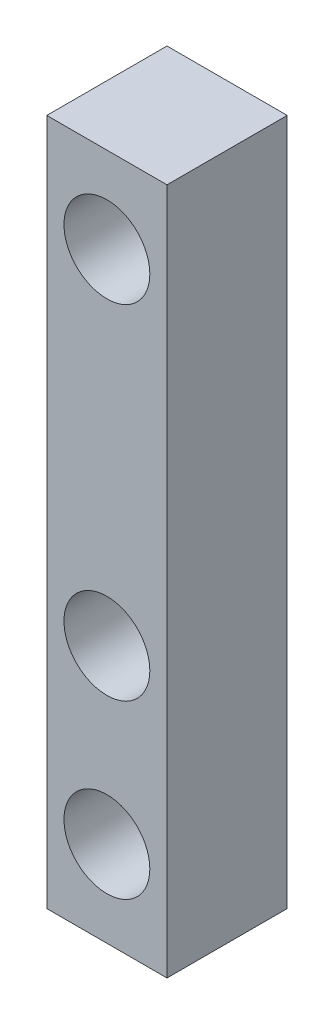
from build123d import *

# Parameters (mm, degrees)
SKETCH1_W           = 7
SKETCH1_H           = 40
BOSS_EXTRUDE1_DEPTH = 7
SKETCH2_R           = 2.5
CUT_EXTRUDE1_DEPTH  = 7


with BuildPart() as part:
    # Sketch1 → Boss-Extrude1 (new body)
    with BuildSketch(Plane.XY):
        with Locations((3.5, 20)):
            Rectangle(SKETCH1_W, SKETCH1_H)
    extrude(amount=BOSS_EXTRUDE1_DEPTH)

    # Sketch2 → Cut-Extrude1 (cut)
    with BuildSketch(Plane.XY.offset(7)):
        with Locations((3.5, 5)):
            Circle(SKETCH2_R)
        with Locations((3.5, 15)):
            Circle(SKETCH2_R)
        with Locations((3.5, 35)):
            Circle(SKETCH2_R)
    extrude(amount=-CUT_EXTRUDE1_DEPTH, mode=Mode.SUBTRACT)


solid = part.part
